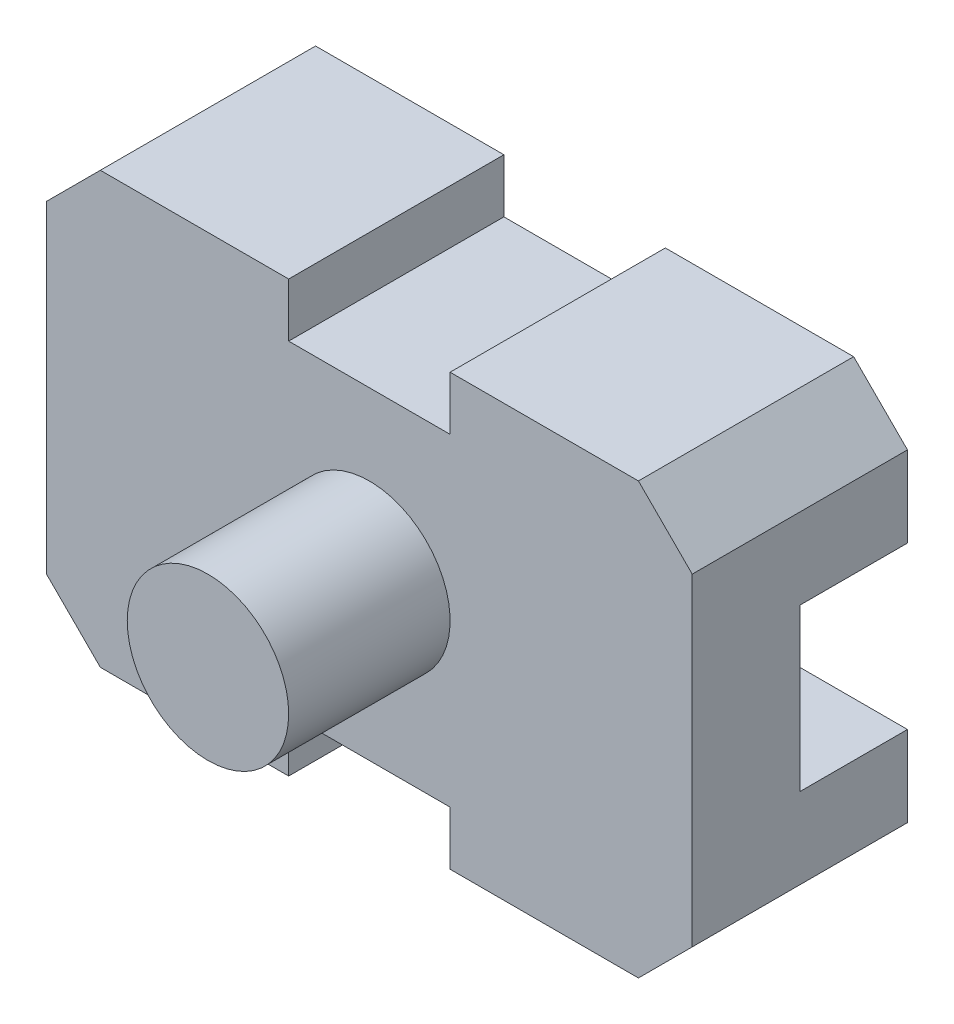
from build123d import *

# Parameters (mm, degrees)
SKETCH_1_W          = 60
SKETCH_1_H          = 40
EXTRUDE_1_DEPTH     = 20
SKETCH_2_R          = 7.5
EXTRUDE_2_DEPTH     = 15
SKETCH_3_W          = 15
SKETCH_3_H          = 5
CUT_EXTRUDE_1_DEPTH = 42.231056256
SKETCH_4_W          = 10
SKETCH_4_H          = 15
CUT_EXTRUDE_2_DEPTH = 73.284161474
CHAMFER_1_SIZE      = 5


with BuildPart() as part:
    # Эскиз1 → Бобышка-Вытянуть1 (new body)
    with BuildSketch(Plane.XY):
        Rectangle(SKETCH_1_W, SKETCH_1_H)
    extrude(amount=EXTRUDE_1_DEPTH)

    # Эскиз2 → Бобышка-Вытянуть2 (add)
    with BuildSketch(Plane.XY.offset(20)):
        with Locations(Location((0, 0, 0), (0, 0, 180))):
            Circle(SKETCH_2_R)
    extrude(amount=EXTRUDE_2_DEPTH)

    # Эскиз3 → Вырез-Вытянуть1 (cut, through all)
    with BuildSketch(Plane.XY.offset(20)):
        with Locations((0, -17.5)):
            Rectangle(SKETCH_3_W, SKETCH_3_H)
    cut_extrude_1 = extrude(amount=-CUT_EXTRUDE_1_DEPTH, mode=Mode.SUBTRACT)

    # Зеркальное отражение1: Вырез-Вытянуть1 across plane
    add(cut_extrude_1.mirror(Plane.ZX), mode=Mode.SUBTRACT)

    # Эскиз4 → Вырез-Вытянуть2 (cut, through all)
    with BuildSketch(Plane.ZY.offset(30)):
        with Locations((5, 0)):
            Rectangle(SKETCH_4_W, SKETCH_4_H)
    extrude(amount=-CUT_EXTRUDE_2_DEPTH, mode=Mode.SUBTRACT)

    # Фаска1
    chamfer_1_edges = [part.edges().sort_by_distance(p)[0] for p in [
        (30, -20, 10),
        (-30, -20, 10),
        (-30, 20, 10),
        (30, 20, 10),
    ]]
    chamfer(chamfer_1_edges, length=CHAMFER_1_SIZE)


solid = part.part
